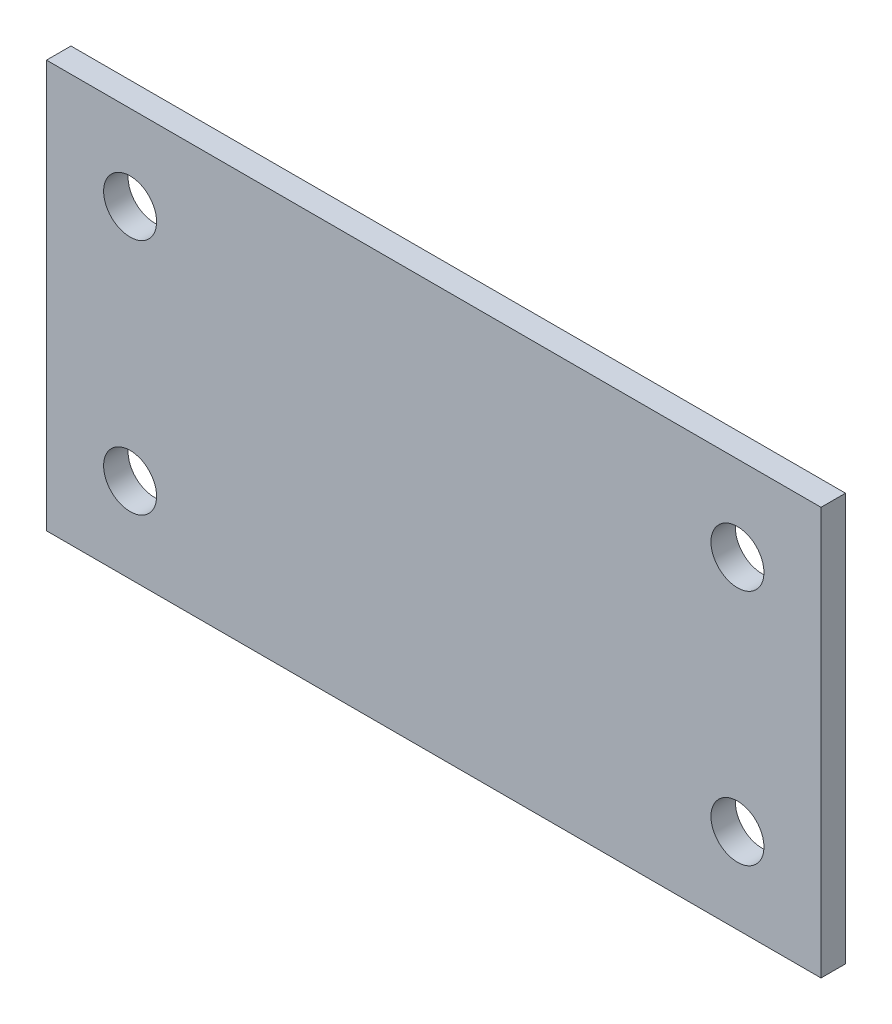
from build123d import *

# Parameters (mm, degrees)
SKETCH_1_W               = 380
SKETCH_1_H               = 200
EXTRUDE_1_DEPTH          = 12
SKETCH_2_R               = 13
CUT_EXTRUDE_1_DEPTH      = 430.585847067
MIRROR_2_COPY_1_SKETCH_R = 13
MIRROR_2_COPY_1_DEPTH    = 430.585847067


with BuildPart() as part:
    # 草图1 → 凸台-拉伸1 (new body)
    with BuildSketch(Plane.XY):
        with Locations((190, 100)):
            Rectangle(SKETCH_1_W, SKETCH_1_H)
    extrude(amount=EXTRUDE_1_DEPTH)

    # 草图2 → 切除-拉伸1 (cut, through all)
    with BuildSketch(Plane.XY.offset(12)):
        with Locations((41.004801127, 41.686787837)):
            Circle(SKETCH_2_R)
    cut_extrude_1 = extrude(amount=-CUT_EXTRUDE_1_DEPTH, mode=Mode.SUBTRACT)

    # 镜向1: 切除-拉伸1 across plane
    add(cut_extrude_1.mirror(Plane.ZX.offset(100)), mode=Mode.SUBTRACT)

    # 镜向2: 切除-拉伸1 across plane
    add(cut_extrude_1.mirror(Plane(origin=(190, 0, 0), x_dir=(0, 0, 1), z_dir=(1, 0, 0))), mode=Mode.SUBTRACT)

    # 镜向2 copy 1 sketch → 镜向2 copy 1 (cut, through all)
    with BuildSketch(Plane(origin=(380, 200, 12), x_dir=(-1, 0, 0), z_dir=(0, 0, 1))):
        with Locations((41.004801127, 41.686787837)):
            Circle(MIRROR_2_COPY_1_SKETCH_R)
    extrude(amount=-MIRROR_2_COPY_1_DEPTH, mode=Mode.SUBTRACT)


solid = part.part
